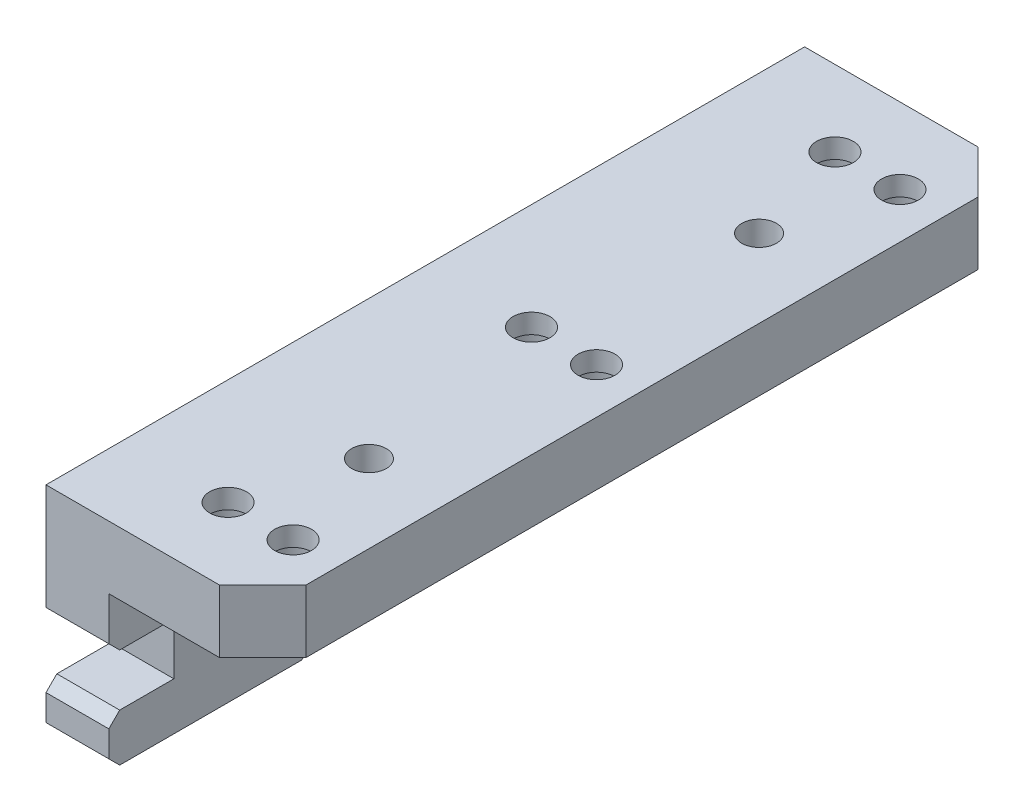
from build123d import *

# Parameters (mm, degrees)
EXTRUDE_1_DEPTH               = 175
EXTRUDE_1_DEPTH_BACK          = 175
SKETCH_2_W                    = 30
SKETCH_2_H                    = 24
CUT_EXTRUDE_1_DEPTH           = 212.186188109
SKETCH_3_R                    = 8
SKETCH_3_R_2                  = 10
CUT_EXTRUDE_2_DEPTH           = 200.099487814
SKETCH_4_W                    = 162
SKETCH_4_H                    = 18
CUT_EXTRUDE_3_DEPTH           = 212.186188109
SKETCH_9_R                    = 8
CUT_EXTRUDE_8_DEPTH           = 197.23996604
CHAMFER_1_SIZE                = 20
CHAMFER_2_SIZE                = 5
HOLE_WIZARD_M16_1_D           = 17
HOLE_WIZARD_M16_1_CBORE_D     = 26
HOLE_WIZARD_M16_1_CBORE_DEPTH = 20
PATTERN_LINEAR_1_COUNT        = 3
PATTERN_LINEAR_1_PITCH        = 140
PATTERN_LINEAR_1_COUNT_DIR2   = 2
PATTERN_LINEAR_1_PITCH_DIR2   = 30
M6X1_0_1_D                    = 5
M6X1_0_1_DEPTH                = 15
M6X1_0_1_TIP                  = 1.502151548


with BuildPart() as part:
    # 草图1 → 拉伸1 (new, two sides: drawn at the far end of the back side and taken through both)
    with BuildSketch(Plane.XY.offset(-EXTRUDE_1_DEPTH_BACK)):
        Polygon((-46.669668375, 36.955523256), (53.330331625, 36.955523256), (53.330331625, 7.955523256), (-17.669668375, 7.955523256), (-17.669668375, -63.044476744), (-46.669668375, -63.044476744), align=None)
    extrude(amount=EXTRUDE_1_DEPTH + EXTRUDE_1_DEPTH_BACK)

    # 草图2 → 切除-拉伸1 (cut, through all)
    with BuildSketch(Plane.ZY.offset(46.669668375)):
        with Locations((160, -29.044476744)):
            Rectangle(SKETCH_2_W, SKETCH_2_H)
    cut_extrude_1 = extrude(amount=-CUT_EXTRUDE_1_DEPTH, mode=Mode.SUBTRACT)

    # 镜向1: 切除-拉伸1 across plane
    add(cut_extrude_1.mirror(Plane.XY), mode=Mode.SUBTRACT)

    # 草图3 → 切除-拉伸2 (cut, through all)
    with BuildSketch(Plane(origin=(-17.669668375, 0, 0), x_dir=(0, 0, -1), z_dir=(1, 0, 0))):
        with Locations(Location((0, -29.044476744, 0), (0, 0, 90))):
            Circle(SKETCH_3_R)
        with Locations(Location((100, -29.044476744, 0), (0, 0, 90))):
            Circle(SKETCH_3_R_2)
        with Locations(Location((-100, -29.044476744, 0), (0, 0, 90))):
            Circle(SKETCH_3_R_2)
    extrude(amount=-CUT_EXTRUDE_2_DEPTH, mode=Mode.SUBTRACT)

    # 草图4 → 切除-拉伸3 (cut, through all)
    with BuildSketch(Plane.ZY.offset(46.669668375)):
        with Locations((0, -54.044476744)):
            Rectangle(SKETCH_4_W, SKETCH_4_H)
    extrude(amount=-CUT_EXTRUDE_3_DEPTH, mode=Mode.SUBTRACT)

    # 草图9 → 切除-拉伸8 (cut, through all)
    with BuildSketch(Plane.XZ.offset(-7.955523256)):
        with Locations(Location((17.330331625, -90, 0), (0, 0, 270))):
            Circle(SKETCH_9_R)
        with Locations(Location((17.330331625, 90, 0), (0, 0, 270))):
            Circle(SKETCH_9_R)
    extrude(amount=-CUT_EXTRUDE_8_DEPTH, mode=Mode.SUBTRACT)

    # 倒角1
    chamfer_1_edges = [part.edges().sort_by_distance(p)[0] for p in [
        (53.330331625, 22.455523256, -175),
        (53.330331625, 22.455523256, 175),
    ]]
    chamfer(chamfer_1_edges, length=CHAMFER_1_SIZE)

    # 倒角2
    chamfer_2_edges = [part.edges().sort_by_distance(p)[0] for p in [
        (-32.169668375, -63.044476744, 175),
        (-32.169668375, -63.044476744, -175),
        (-32.169668375, -17.044476744, 175),
        (-32.169668375, -41.044476744, 175),
        (-32.169668375, -41.044476744, -175),
        (-32.169668375, -17.044476744, -175),
        (-32.169668375, -63.044476744, -81),
        (-32.169668375, -63.044476744, 81),
    ]]
    chamfer(chamfer_2_edges, length=CHAMFER_2_SIZE)

    # M16 六角凹头螺钉的柱形沉头孔1 (through all)
    with Locations(Plane.XZ.offset(-7.955523256)):
        with Locations((2.330331625, -140)):
            hole_wizard_m16_1 = CounterBoreHole(HOLE_WIZARD_M16_1_D / 2, HOLE_WIZARD_M16_1_CBORE_D / 2, HOLE_WIZARD_M16_1_CBORE_DEPTH)

    # 阵列(线性)1: Hole Wizard M16 _1 3 × 2
    with Locations(*[(j * PATTERN_LINEAR_1_PITCH_DIR2, 0, i * PATTERN_LINEAR_1_PITCH) for i in range(PATTERN_LINEAR_1_COUNT) for j in range(PATTERN_LINEAR_1_COUNT_DIR2) if (i, j) != (0, 0)]):
        add(hole_wizard_m16_1, mode=Mode.SUBTRACT)

    # M6x1.0 螺纹孔1
    with Locations(Plane.ZY.offset(46.669668375)):
        with Locations((80, 0), (-80, 0)):
            Hole(M6X1_0_1_D / 2, depth=M6X1_0_1_DEPTH)
            with Locations((0, 0, -(M6X1_0_1_DEPTH + M6X1_0_1_TIP / 2))):  # 118° drill point
                Cone(0, M6X1_0_1_D / 2, M6X1_0_1_TIP, mode=Mode.SUBTRACT)


solid = part.part
